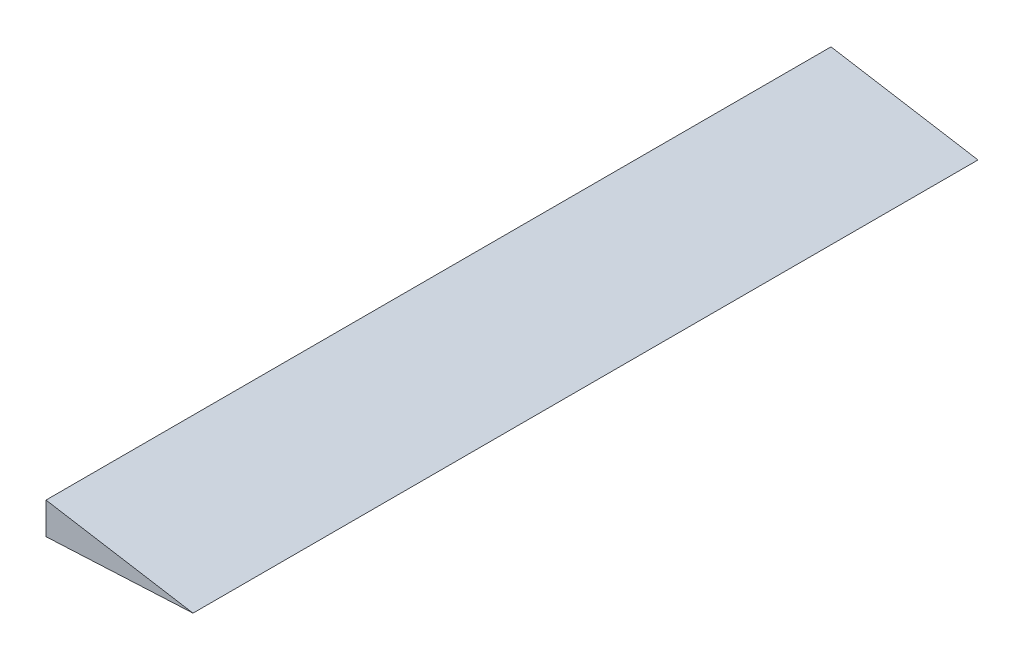
from build123d import *

# Parameters (mm, degrees)
BOSS_EXTRUDE2_DEPTH = 271.272


with BuildPart() as part:
    # Sketch2 → Boss-Extrude2 (new body)
    with BuildSketch(Plane(origin=(0, 0, -761.999746), x_dir=(-1, 0, 0), z_dir=(0, 0, -1))):
        Polygon((-306.8495768, -2.516115741), (-306.8495768, 8.449856001), (-357.6495768, 0), align=None)
    extrude(amount=-BOSS_EXTRUDE2_DEPTH)


solid = part.part
